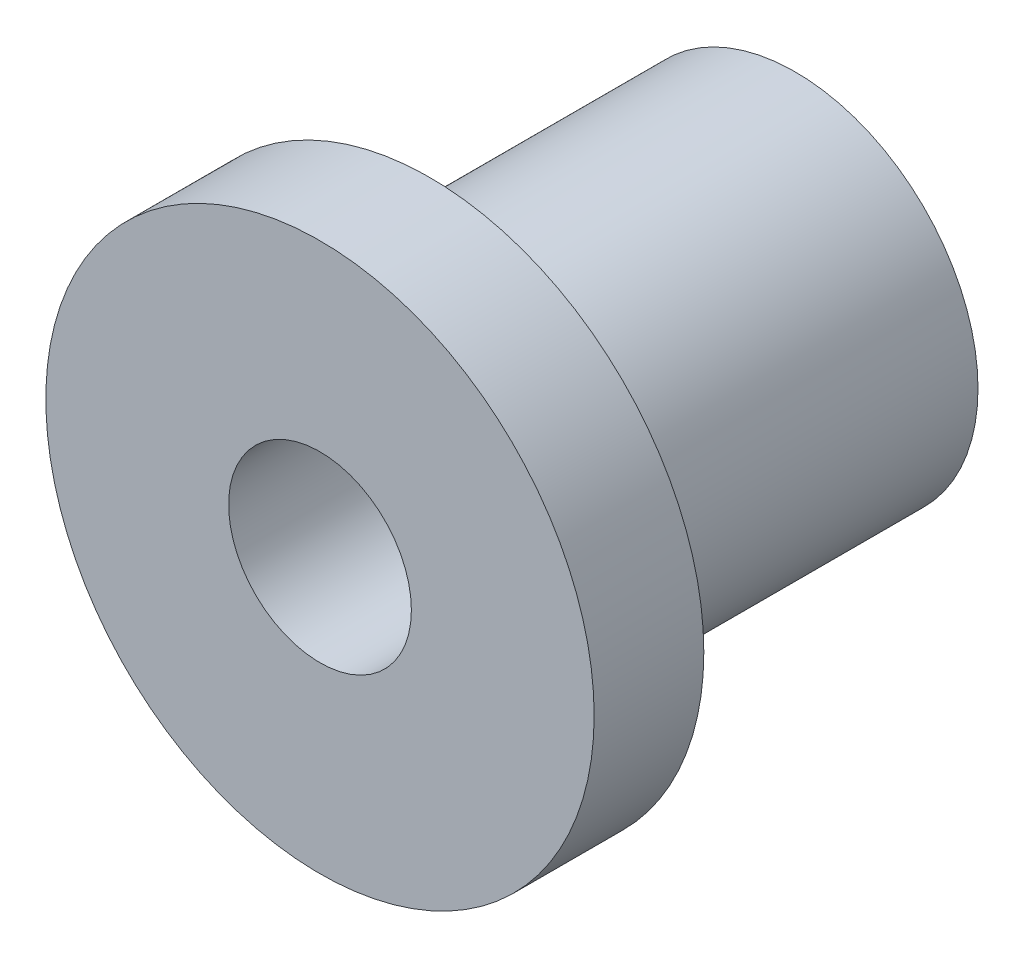
from build123d import *

# Parameters (mm, degrees)
CROQUIS1_R              = 5
CROQUIS1_R_2            = 2.5
SALIENTE_EXTRUIR1_DEPTH = 10
CROQUIS2_R              = 7.5
CROQUIS2_R_2            = 2.5
SALIENTE_EXTRUIR2_DEPTH = 3


with BuildPart() as part:
    # Croquis1 → Saliente-Extruir1 (new body)
    with BuildSketch(Plane.XY):
        Circle(CROQUIS1_R)
        Circle(CROQUIS1_R_2, mode=Mode.SUBTRACT)
    extrude(amount=SALIENTE_EXTRUIR1_DEPTH)

    # Croquis2 → Saliente-Extruir2 (add)
    with BuildSketch(Plane.XY.offset(10)):
        Circle(CROQUIS2_R)
        Circle(CROQUIS2_R_2, mode=Mode.SUBTRACT)
    extrude(amount=SALIENTE_EXTRUIR2_DEPTH)


solid = part.part
